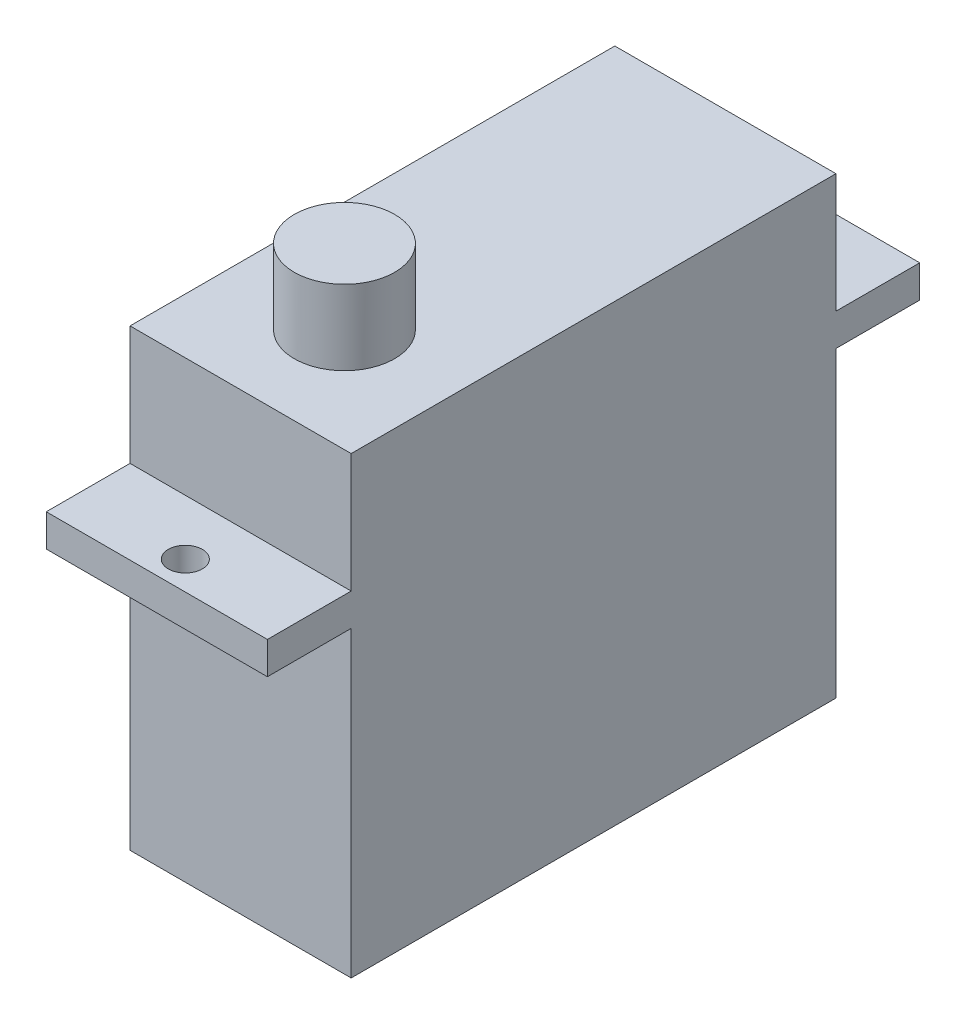
from build123d import *

# Parameters (mm, degrees)
EXTRUDE_1_DEPTH     = 13
SKETCH_4_R          = 1
CUT_EXTRUDE_1_DEPTH = 31.410041516
SKETCH_6_R          = 2.95
EXTRUDE_2_DEPTH     = 4.4


with BuildPart() as part:
    # 草圖1 → 填料-伸長1 (new body)
    with BuildSketch(Plane(origin=(0, 0, 0), x_dir=(0, 0, -1), z_dir=(1, 0, 0))):
        Polygon((14.25, 10.8), (19.175, 10.8), (19.175, 8.9), (14.25, 8.9), (14.25, -8.9), (-14.25, -8.9), (-14.25, 8.9), (-19.175, 8.9), (-19.175, 10.8), (-14.25, 10.8), (-14.25, 17.8), (14.25, 17.8), align=None)
    extrude(amount=EXTRUDE_1_DEPTH)

    # 草圖4 → 除料-伸長1 (cut, through all)
    with BuildSketch(Plane(origin=(0, 10.8, 0), x_dir=(1, 0, 0), z_dir=(0, 1, 0))):
        with Locations(Location((6.5, 17.5, 0), (0, 0, 270))):
            Circle(SKETCH_4_R)
        with Locations(Location((6.5, -17.5, 0), (0, 0, 270))):
            Circle(SKETCH_4_R)
    extrude(amount=-CUT_EXTRUDE_1_DEPTH, mode=Mode.SUBTRACT)

    # 草圖6 → 填料-伸長2 (add)
    with BuildSketch(Plane(origin=(0, 17.8, 0), x_dir=(1, 0, 0), z_dir=(0, 1, 0))):
        with Locations(Location((6.5, -8.145, 0), (0, 0, 90))):
            Circle(SKETCH_6_R)
    extrude(amount=EXTRUDE_2_DEPTH)


solid = part.part
